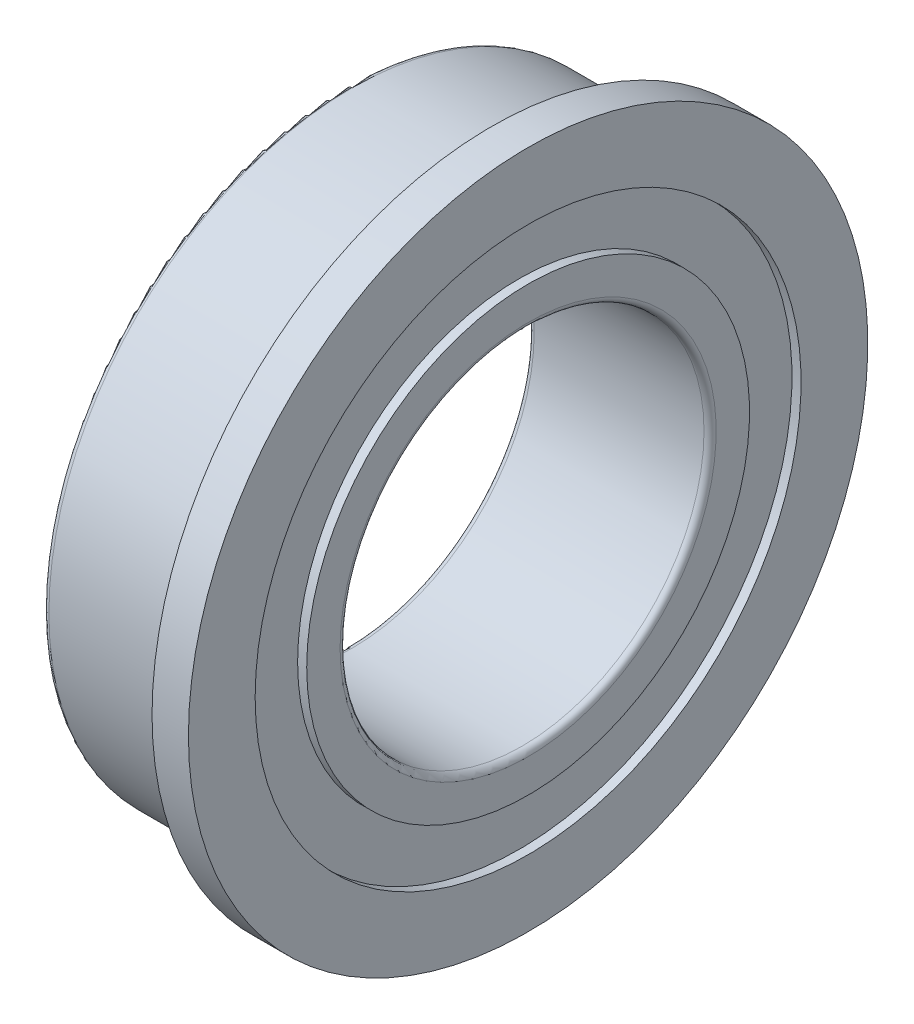
from build123d import *


with BuildPart() as part:
    # Sketch1 → Revolve1 (revolve)
    with BuildSketch(Plane.XY):
        with BuildLine():
            Line((0, 5.2), (0, 5.6))
            Line((0, 5.6), (0.6, 5.6))
            Line((0.6, 5.6), (0.6, 4.5))
            Line((0.6, 4.5), (0.45, 4.5))
            Line((0.45, 4.5), (0.45, 3.65))
            Line((0.45, 3.65), (0.6, 3.65))
            Line((0.6, 3.65), (0.6, 3.1))
            ThreePointArc((0.6, 3.1), (0.570710678, 3.029289322), (0.5, 3))
            Line((0.5, 3), (-2.3, 3))
            ThreePointArc((-2.3, 3), (-2.370710678, 3.029289322), (-2.4, 3.1))
            Line((-2.4, 3.1), (-2.4, 3.65))
            Line((-2.4, 3.65), (-2.25, 3.65))
            Line((-2.25, 3.65), (-2.25, 4.5))
            Line((-2.25, 4.5), (-2.4, 4.5))
            Line((-2.4, 4.5), (-2.4, 4.9))
            ThreePointArc((-2.4, 4.9), (-2.370710678, 4.970710678), (-2.3, 5))
            Line((-2.3, 5), (-0.2, 5))
            ThreePointArc((-0.2, 5), (0.141421356, 4.858578644), (0, 5.2))
        make_face()
    revolve(axis=Axis((-2.55, 0, 0), (1, 0, 0)))


solid = part.part
